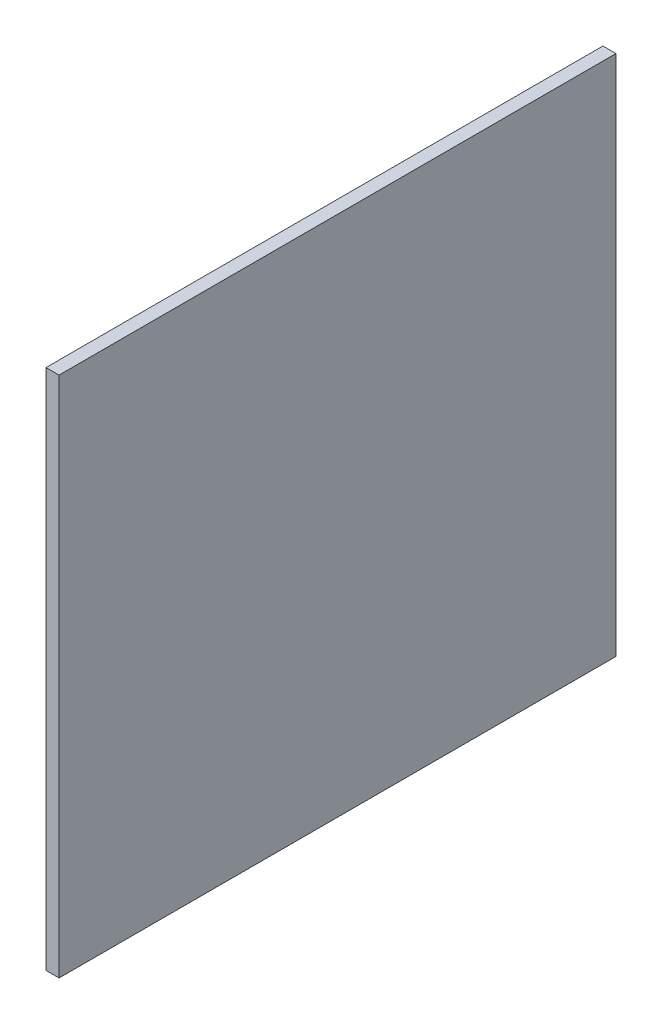
from build123d import *

# Parameters (mm, degrees)
SKETCH1_W           = 19.05
SKETCH1_H           = 762
BOSS_EXTRUDE1_DEPTH = 812.8


with BuildPart() as part:
    # Sketch1 → Boss-Extrude1 (new body)
    with BuildSketch(Plane.XY):
        with Locations((-99.00949825, 377.096787186)):
            Rectangle(SKETCH1_W, SKETCH1_H)
    extrude(amount=BOSS_EXTRUDE1_DEPTH)


solid = part.part
